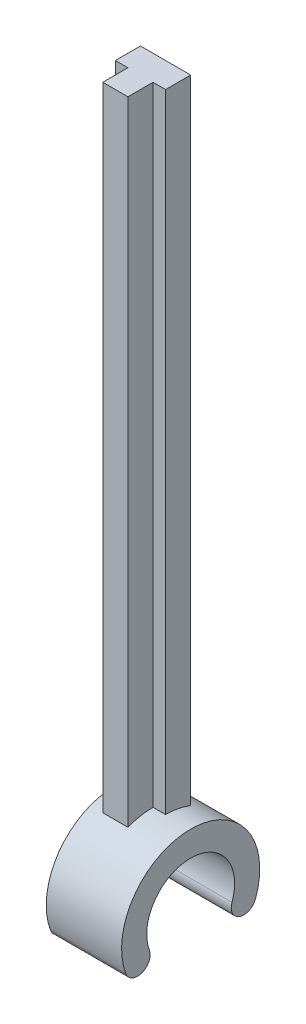
from build123d import *

# Parameters (mm, degrees)
BOSS_EXTRUDE1_DEPTH      = 4
BOSS_EXTRUDE1_DEPTH_BACK = 2
BOSS_EXTRUDE2_DEPTH      = 2
BOSS_EXTRUDE2_DEPTH_BACK = 2
BOSS_EXTRUDE3_DEPTH      = 1
BOSS_EXTRUDE3_DEPTH_BACK = 1
SKETCH3_W                = 2
SKETCH3_H                = 52


with BuildPart() as part:
    # Sketch1 → Boss-Extrude1 (new, two sides: drawn at the far end of the back side and taken through both)
    with BuildSketch(Plane(origin=(0, 0, 0), x_dir=(0, 0, -1), z_dir=(1, 0, 0)).offset(-BOSS_EXTRUDE1_DEPTH_BACK)):
        with BuildLine():
            ThreePointArc((-3.288924173, -1.197070502), (0, 3.5), (3.288924173, -1.197070502))
            ThreePointArc((3.288924173, -1.197070502), (3.88659665, -2.478783266), (5.168309414, -1.881110788))
            ThreePointArc((5.168309414, -1.881110788), (0, 5.5), (-5.168309414, -1.881110788))
            ThreePointArc((-5.168309414, -1.881110788), (-3.88659665, -2.478783266), (-3.288924173, -1.197070502))
        make_face()
    extrude(amount=BOSS_EXTRUDE1_DEPTH + BOSS_EXTRUDE1_DEPTH_BACK)

    # Sketch2 → Boss-Extrude2 (add, two sides: drawn at the far end of the back side and taken through both)
    with BuildSketch(Plane(origin=(0, 0, 0), x_dir=(0, 0, -1), z_dir=(1, 0, 0)).offset(-BOSS_EXTRUDE2_DEPTH_BACK)):
        Polygon((0, 5.5), (0, 3.5), (2, 3.5), (2, 55.5), (0, 55.5), align=None)
    extrude(amount=BOSS_EXTRUDE2_DEPTH + BOSS_EXTRUDE2_DEPTH_BACK)

    # Sketch3 → Boss-Extrude3 (add, two sides: drawn at the far end of the back side and taken through both)
    with BuildSketch(Plane(origin=(0, 0, 0), x_dir=(0, 0, -1), z_dir=(1, 0, 0)).offset(-BOSS_EXTRUDE3_DEPTH_BACK)):
        with Locations((-1, 29.5)):
            Rectangle(SKETCH3_W, SKETCH3_H)
    extrude(amount=BOSS_EXTRUDE3_DEPTH + BOSS_EXTRUDE3_DEPTH_BACK)


solid = part.part
